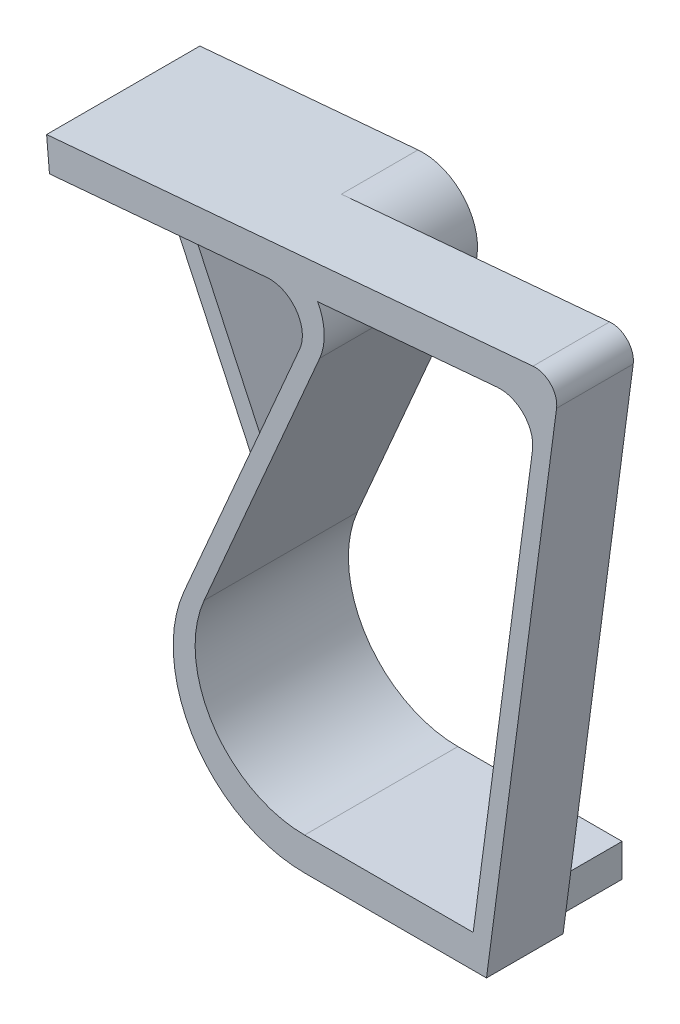
from build123d import *

# Parameters (mm, degrees)
BOSS_EXTRUDE1_DEPTH      = 7
BOSS_EXTRUDE1_DEPTH_BACK = 7
BOSS_EXTRUDE2_DEPTH      = 7
BOSS_EXTRUDE3_DEPTH      = 7


with BuildPart() as part:
    # Sketch1 → Boss-Extrude1 (new, two sides: drawn at the far end of the back side and taken through both)
    with BuildSketch(Plane.XY.offset(-BOSS_EXTRUDE1_DEPTH_BACK)):
        with BuildLine():
            Line((-17.458418155, -11.36484808), (2.465475807, -9.621733225))
            ThreePointArc((2.465475807, -9.621733225), (6.955793602, -11.676837129), (7.491085956, -16.585998774))
            Line((7.491085956, -16.585998774), (-3.072780906, -41.033415882))
            ThreePointArc((-3.072780906, -41.033415882), (-2.24972743, -50.492456592), (6.106881965, -55))
            Line((6.106881965, -55), (21.106881965, -55))
            Line((21.106881965, -55), (21.106881965, -58))
            Line((21.106881965, -58), (6.106881965, -58))
            ThreePointArc((6.106881965, -58), (-3.921049309, -52.59094791), (-4.908713481, -41.240099059))
            Line((-4.908713481, -41.240099059), (5.655153382, -16.79268195))
            ThreePointArc((5.655153382, -16.79268195), (5.333977969, -13.847184963), (2.639787292, -12.614122621))
            Line((2.639787292, -12.614122621), (-17.197282581, -14.349641352))
            Line((-17.197282581, -14.349641352), (-17.458418155, -11.36484808))
        make_face()
    extrude(amount=BOSS_EXTRUDE1_DEPTH + BOSS_EXTRUDE1_DEPTH_BACK)

    # Sketch3 → Boss-Extrude2 (add)
    with BuildSketch(Plane.XY):
        with BuildLine():
            Line((2.465475807, -9.621733225), (26.965836734, -7.478229391))
            ThreePointArc((26.965836734, -7.478229391), (28.585544777, -8.088291477), (29.122784537, -9.733588816))
            Line((29.122784537, -9.733588816), (22.720894567, -58))
            Line((22.720894567, -58), (21.106881965, -58))
            Line((21.106881965, -58), (21.106881965, -55))
            Line((21.106881965, -55), (21.504791597, -55))
            Line((21.504791597, -55), (26.921714347, -14.159650971))
            ThreePointArc((26.921714347, -14.159650971), (26.115854708, -11.691704962), (23.686292644, -10.776611833))
            Line((23.686292644, -10.776611833), (2.726943035, -12.610317319))
            Line((2.726943035, -12.610317319), (2.465475807, -9.621733225))
        make_face()
    extrude(amount=BOSS_EXTRUDE2_DEPTH)

    # Sketch4 → Boss-Extrude3 (add)
    with BuildSketch(Plane.XY):
        Polygon((-15.197282581, -14.174664025), (-3.7781853, -38.623775477), (-2.92955004, -36.659822272), (-13.500697735, -14.026232084), align=None)
    extrude(amount=-BOSS_EXTRUDE3_DEPTH)


solid = part.part
